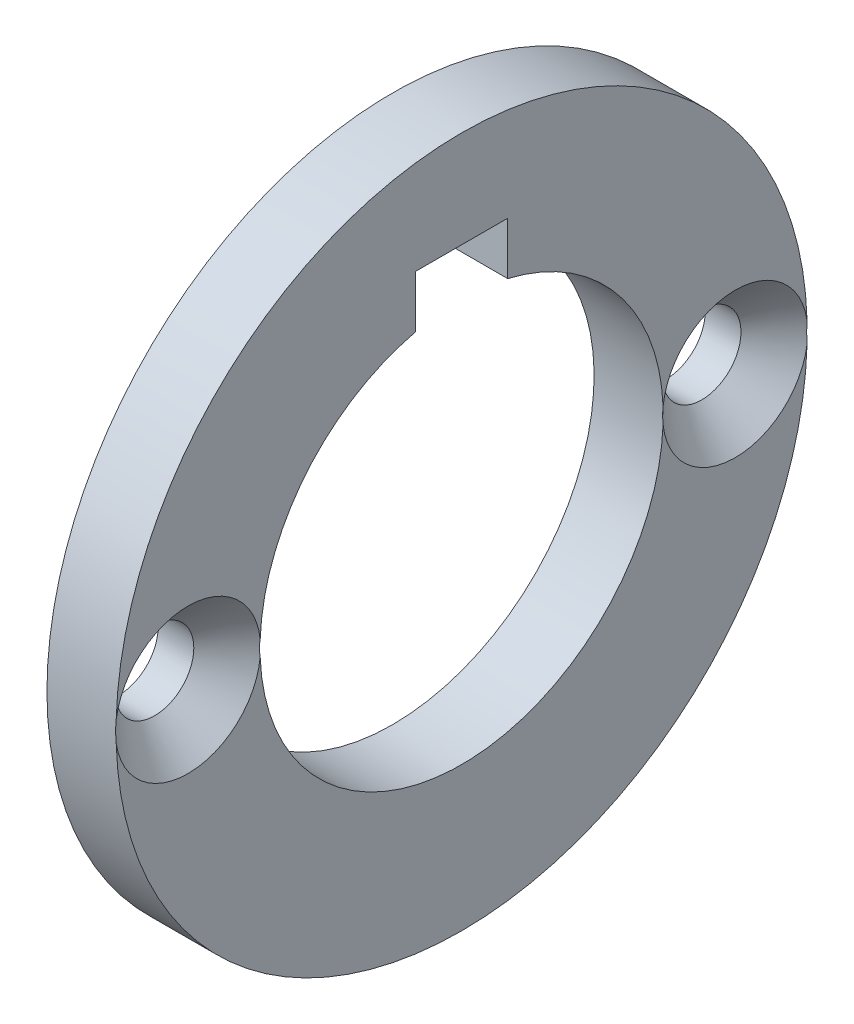
from build123d import *

# Parameters (mm, degrees)
SKETCH1_W                                           = 3
SKETCH1_H                                           = 6.25
SKETCH2_R                                           = 1.5
SKETCH2_W                                           = 4
SKETCH2_H                                           = 4
CUT_EXTRUDE1_DEPTH                                  = 10
CSK_FOR_M3_COUNTERSUNK_FLAT_HEAD_SCREW1_D           = 3.4
CSK_FOR_M3_COUNTERSUNK_FLAT_HEAD_SCREW1_DEPTH       = 20.003
CSK_FOR_M3_COUNTERSUNK_FLAT_HEAD_SCREW1_CSINK_D     = 6.3
CSK_FOR_M3_COUNTERSUNK_FLAT_HEAD_SCREW1_CSINK_ANGLE = 90
CSK_FOR_M3_COUNTERSUNK_FLAT_HEAD_SCREW1_TIP         = 1.021463052


with BuildPart() as part:
    # Sketch1 → Base-Revolve (revolve)
    with BuildSketch(Plane.XY, mode=Mode.PRIVATE) as base_revolve_sk:
        with Locations((-1.5, 11.875)):
            Rectangle(SKETCH1_W, SKETCH1_H)
    revolve(base_revolve_sk.sketch.rotate(Axis((-34.925, 0, 0), (1, 0, 0)), 90), axis=Axis((-34.925, 0, 0), (1, 0, 0)))

    # Sketch2 → Cut-Extrude1 (cut)
    with BuildSketch(Plane(origin=(0, 0, 0), x_dir=(0, 0, -1), z_dir=(1, 0, 0))):
        with Locations((-11.875, 0)):
            Circle(SKETCH2_R)
        with Locations((11.875, 0)):
            Circle(SKETCH2_R)
        with Locations((0, 8.789946371)):
            Rectangle(SKETCH2_W, SKETCH2_H)
    extrude(amount=-CUT_EXTRUDE1_DEPTH, mode=Mode.SUBTRACT)

    # CSK for M3 Countersunk Flat Head Screw1
    with Locations(Plane(origin=(0, 0, 0), x_dir=(0, 0, -1), z_dir=(1, 0, 0))):
        with Locations((-11.875, 0), (11.875, 0)):
            CounterSinkHole(CSK_FOR_M3_COUNTERSUNK_FLAT_HEAD_SCREW1_D / 2, CSK_FOR_M3_COUNTERSUNK_FLAT_HEAD_SCREW1_CSINK_D / 2, depth=CSK_FOR_M3_COUNTERSUNK_FLAT_HEAD_SCREW1_DEPTH, counter_sink_angle=CSK_FOR_M3_COUNTERSUNK_FLAT_HEAD_SCREW1_CSINK_ANGLE)
            with Locations((0, 0, -(CSK_FOR_M3_COUNTERSUNK_FLAT_HEAD_SCREW1_DEPTH + CSK_FOR_M3_COUNTERSUNK_FLAT_HEAD_SCREW1_TIP / 2))):  # 118° drill point
                Cone(0, CSK_FOR_M3_COUNTERSUNK_FLAT_HEAD_SCREW1_D / 2, CSK_FOR_M3_COUNTERSUNK_FLAT_HEAD_SCREW1_TIP, mode=Mode.SUBTRACT)


solid = part.part
